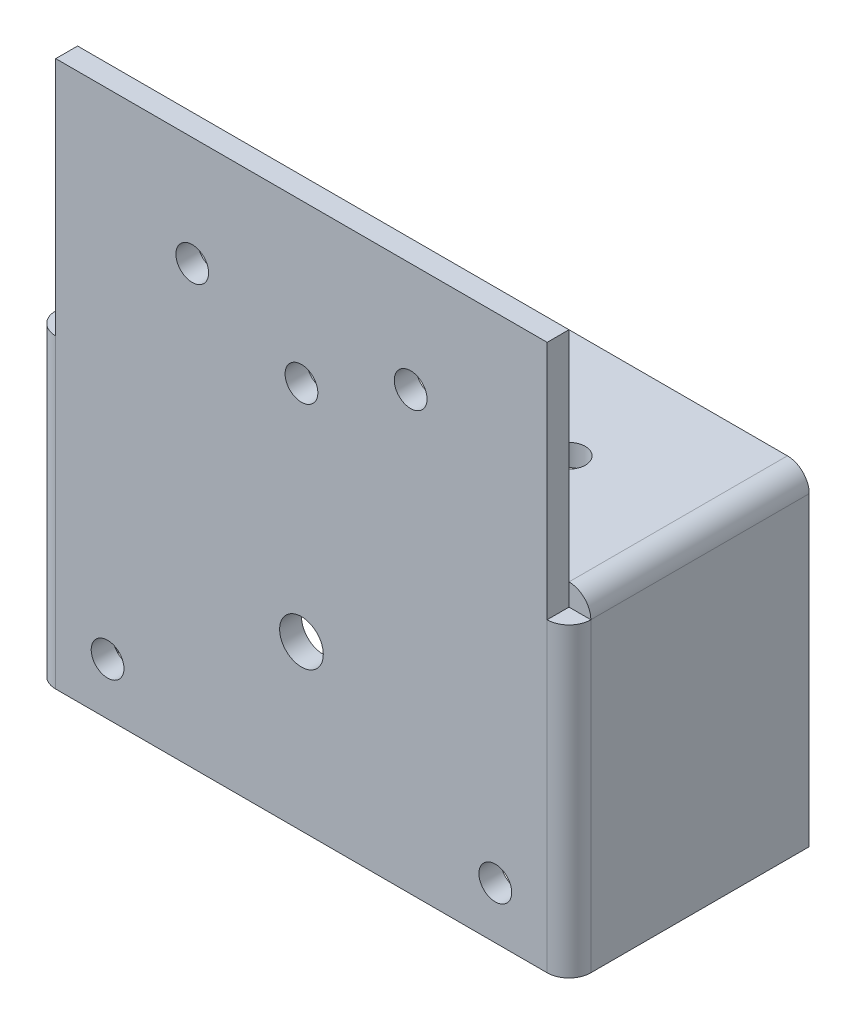
from build123d import *

# Parameters (mm, degrees)
SKETCH1_W               = 49
SKETCH1_H               = 50
BOSS_EXTRUDE1_DEPTH     = 2
SKETCH3_W               = 2
SKETCH3_H               = 22
CUT_EXTRUDE1_DEPTH      = 36.060661717
BOSS_EXTRUDE5_DEPTH     = 20
FILLET3_R               = 2
FILLET4_R               = 1
SKETCH8_R               = 2
SKETCH8_R_2             = 1.5
CUT_EXTRUDE2_DEPTH      = 10
CUT_EXTRUDE3_DEPTH      = 44.591857038
CUT_EXTRUDE3_DEPTH_BACK = 44.591857038
SKETCH9_R               = 1.5


with BuildPart() as part:
    # Sketch1 → Boss-Extrude1 (new body)
    with BuildSketch(Plane.XY):
        Rectangle(SKETCH1_W, SKETCH1_H)
    extrude(amount=BOSS_EXTRUDE1_DEPTH)

    # Sketch3 → Cut-Extrude1 (cut, through all)
    with BuildSketch(Plane.XY.offset(2)):
        with Locations((-23.5, 14)):
            Rectangle(SKETCH3_W, SKETCH3_H)
        with Locations((23.5, 14)):
            Rectangle(SKETCH3_W, SKETCH3_H)
    extrude(amount=-CUT_EXTRUDE1_DEPTH, mode=Mode.SUBTRACT)

    # Sketch7 → Boss-Extrude5 (add)
    with BuildSketch(Plane(origin=(0, 0, 0), x_dir=(-1, 0, 0), z_dir=(0, 0, -1))):
        Polygon((-24.5, -25), (-24.5, 5), (-2.49, 5), (-2.49, 3), (-22.49, 3), (-22.49, -25), align=None)
        Polygon((24.5, 5), (2.49, 5), (2.49, 3), (22.49, 3), (22.49, -25), (24.5, -25), align=None)
    extrude(amount=BOSS_EXTRUDE5_DEPTH)

    # Fillet3
    fillet3_edges = [part.edges().sort_by_distance(p)[0] for p in [
        (-24.5, 5, -10),
        (24.5, 5, -10),
        (-24.5, -11, 2),
        (24.5, -11, 2),
    ]]
    fillet(fillet3_edges, radius=FILLET3_R)

    # Fillet4
    fillet4_edges = [part.edges().sort_by_distance(p)[0] for p in [
        (22.49, -11, 0),
        (22.49, 3, -10),
        (-22.49, -11, 0),
        (-22.49, 3, -10),
    ]]
    fillet(fillet4_edges, radius=FILLET4_R)

    # Sketch8 → Cut-Extrude2 (cut)
    with BuildSketch(Plane.XY.offset(2)):
        with Locations((0, -10)):
            Circle(SKETCH8_R)
        with Locations((0, 10.5)):
            Circle(SKETCH8_R_2)
        with Locations((17.753520778, -20.25)):
            Circle(SKETCH8_R_2)
        with Locations((-17.753520778, -20.25)):
            Circle(SKETCH8_R_2)
        with Locations((-10, 15)):
            Circle(SKETCH8_R_2)
        with Locations(Location((10, 15, 0), (0, 0, 180))):
            Circle(SKETCH8_R_2)
    extrude(amount=-CUT_EXTRUDE2_DEPTH, mode=Mode.SUBTRACT)

    # Sketch9 → Cut-Extrude3 (cut, two sides: drawn at the far end of the back side and taken through both)
    with BuildSketch(Plane(origin=(0, 5, 0), x_dir=(1, 0, 0), z_dir=(0, 1, 0)).offset(-CUT_EXTRUDE3_DEPTH_BACK)):
        with Locations(Location((12.495, 10, 0), (0, 0, 270))):
            Circle(SKETCH9_R)
        with Locations(Location((-12.495, 10, 0), (0, 0, 270))):
            Circle(SKETCH9_R)
    extrude(amount=CUT_EXTRUDE3_DEPTH + CUT_EXTRUDE3_DEPTH_BACK, mode=Mode.SUBTRACT)


solid = part.part
